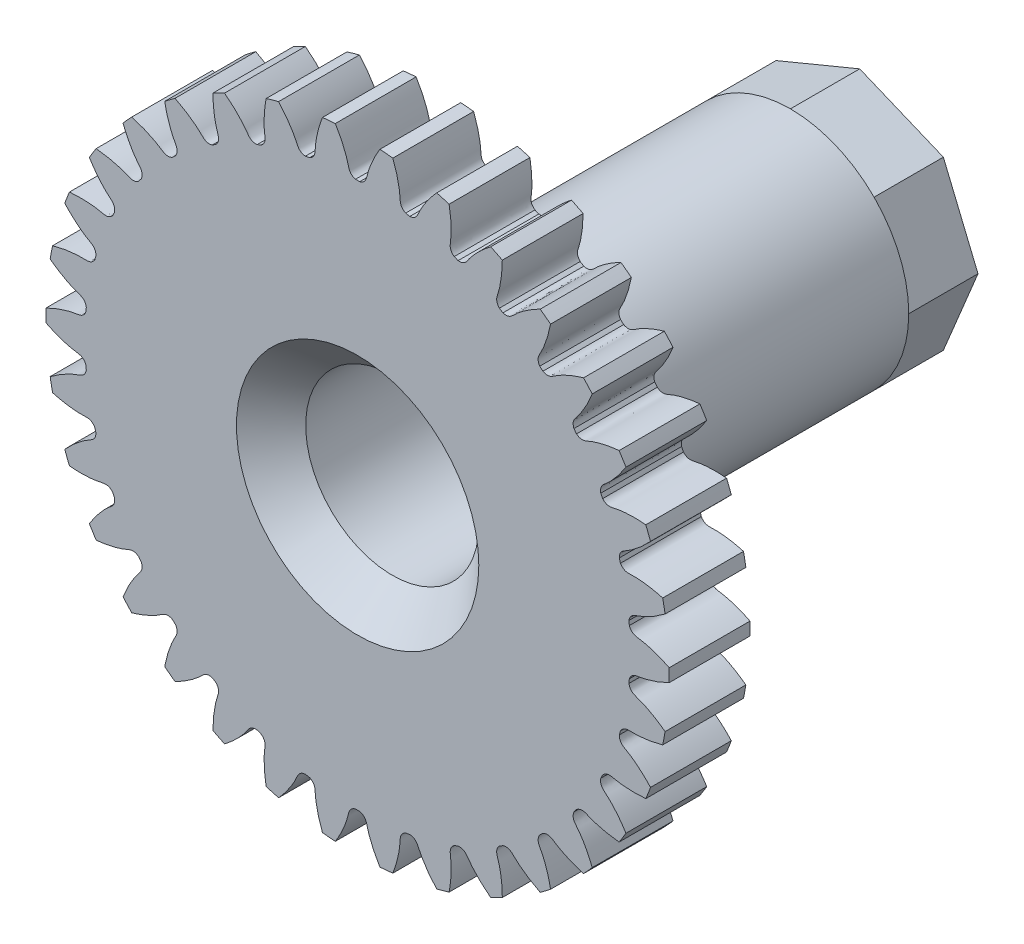
from build123d import *

# Parameters (mm, degrees)
SKETCH_1_R               = 27
EXTRUDE_1_DEPTH          = 7
CUT_EXTRUDE_1_DEPTH      = 39.820097888
PATTERN_CIRCULAR_1_COUNT = 34
EXTRUDE_START            = -7
SKETCH_5_R               = 21
EXTRUDE_2_DEPTH          = 1
SKETCH_4_R               = 7.5
CUT_EXTRUDE_2_DEPTH      = 39.964927539
CHAMFER_1_SIZE           = 3
EXTRUDE_START_2          = -8
SKETCH_6_R               = 10.25
SKETCH_6_R_2             = 7.5
EXTRUDE_3_DEPTH          = 35.5
CHAMFER_1_2_SIZE         = 3
SKETCH_7_OUTSIDE_W       = 73.56
SKETCH_7_OUTSIDE_H       = 73.422
CUT_EXTRUDE_3_DEPTH      = 6


with BuildPart() as part:
    # 草图1 → 凸台-拉伸1 (new body)
    with BuildSketch(Plane.XY):
        Circle(SKETCH_1_R)
    extrude(amount=EXTRUDE_1_DEPTH)

    # 草图2 → 切除-拉伸1 (cut, through all)
    with BuildSketch(Plane.XY):
        with BuildLine():
            ThreePointArc((0.183171175, 23.624289901), (0, 23.625), (-0.183171175, 23.624289901))
            add(Edge.make_bspline(
                [(-0.183171175, 23.624289901), (-0.716587806, 23.775112896), (-0.763410395, 24.188787315), (-0.879946356, 24.623629896), (-0.912930358, 24.738245821), (-0.951084244, 24.861314333), (-0.99469329, 24.992699977), (-1.044123655, 25.132221413), (-1.099711127, 25.279697341), (-1.161793992, 25.434932943), (-1.230702926, 25.597724076), (-1.306763614, 25.76785621), (-1.390295632, 25.945104927), (-1.481612426, 26.129235971), (-1.581020975, 26.320005435), (-1.688821555, 26.51715992), (-1.805307471, 26.720436707), (-1.930764813, 26.929563939), (-2.065472203, 27.144260803), (-2.209700557, 27.364237722), (-2.36371284, 27.589196551), (-2.527763841, 27.818830783), (-2.702099938, 28.052825758), (-2.886958877, 28.290858874), (-3.082569553, 28.532599812), (-3.289151799, 28.777710761), (-3.506916179, 29.025846649), (-3.73606378, 29.276655378), (-3.97678604, 29.52977807), (-4.229264468, 29.784849315), (-4.586391615, 30.131497572), (-4.865591808, 30.386500811), (-5.057363345, 30.554916542)],
                knots=[0, 0, 0, 0, 0.13072362, 0.143503881, 0.157401081, 0.17241522, 0.188546299, 0.205794316, 0.224159273, 0.243641169, 0.264240005, 0.285955779, 0.308788493, 0.332738146, 0.357804738, 0.383988269, 0.411288739, 0.439706149, 0.469240498, 0.499891786, 0.531660014, 0.56454518, 0.598547286, 0.633666331, 0.669902315, 0.707255238, 0.745725101, 0.785311903, 0.826015644, 0.867836324, 0.910773943, 1, 1, 1, 1], degree=3))
            ThreePointArc((-5.057363345, 30.554916542), (0, 30.970628811), (5.057363345, 30.554916542))
            add(Edge.make_bspline(
                [(0.183171175, 23.624289901), (0.716587806, 23.775112896), (0.763410395, 24.188787315), (0.879946356, 24.623629896), (0.912930358, 24.738245821), (0.951084244, 24.861314333), (0.99469329, 24.992699977), (1.044123655, 25.132221413), (1.099711127, 25.279697341), (1.161793992, 25.434932943), (1.230702926, 25.597724076), (1.306763614, 25.76785621), (1.390295632, 25.945104927), (1.481612426, 26.129235971), (1.581020975, 26.320005435), (1.688821555, 26.51715992), (1.805307471, 26.720436707), (1.930764813, 26.929563939), (2.065472203, 27.144260803), (2.209700557, 27.364237722), (2.36371284, 27.589196551), (2.527763841, 27.818830783), (2.702099938, 28.052825758), (2.886958877, 28.290858874), (3.082569553, 28.532599812), (3.289151799, 28.777710761), (3.506916179, 29.025846649), (3.73606378, 29.276655378), (3.97678604, 29.52977807), (4.229264468, 29.784849315), (4.586391615, 30.131497572), (4.865591808, 30.386500811), (5.057363345, 30.554916542)],
                knots=[0, 0, 0, 0, 0.13072362, 0.143503881, 0.157401081, 0.17241522, 0.188546299, 0.205794316, 0.224159273, 0.243641169, 0.264240005, 0.285955779, 0.308788493, 0.332738146, 0.357804738, 0.383988269, 0.411288739, 0.439706149, 0.469240498, 0.499891786, 0.531660014, 0.56454518, 0.598547286, 0.633666331, 0.669902315, 0.707255238, 0.745725101, 0.785311903, 0.826015644, 0.867836324, 0.910773943, 1, 1, 1, 1], degree=3))
        make_face()
    cut_extrude_1 = extrude(amount=CUT_EXTRUDE_1_DEPTH, mode=Mode.SUBTRACT)

    # 阵列(圆周)1: 切除-拉伸1 ×34 about axis
    pattern_circular_1_axis = Axis((0, 0, -1.5), (0, 0, 1))
    for i in range(1, PATTERN_CIRCULAR_1_COUNT):
        add(cut_extrude_1.rotate(pattern_circular_1_axis, i * 360 / PATTERN_CIRCULAR_1_COUNT), mode=Mode.SUBTRACT)

    # 草图5 → 凸台-拉伸2 (add)
    with BuildSketch(Plane.XY.offset(7).offset(EXTRUDE_START)):
        Circle(SKETCH_5_R)
    extrude(amount=-EXTRUDE_2_DEPTH)

    # 草图4 → 切除-拉伸2 (cut, through all)
    with BuildSketch(Plane.XY.offset(7)):
        Circle(SKETCH_4_R)
    extrude(amount=-CUT_EXTRUDE_2_DEPTH, mode=Mode.SUBTRACT)

    # 倒角1
    chamfer_1_edges = [part.edges().sort_by_distance(p)[0] for p in [
        (-7.5, 0, 7),
    ]]
    chamfer(chamfer_1_edges, length=CHAMFER_1_SIZE)

    # 草图6 → 凸台-拉伸3 (add)
    with BuildSketch(Plane.XY.offset(7).offset(EXTRUDE_START_2)):
        Circle(SKETCH_6_R)
        Circle(SKETCH_6_R_2, mode=Mode.SUBTRACT)
    extrude(amount=-EXTRUDE_3_DEPTH)

    # Chamfer 1 2
    chamfer_1_2_edges = [part.edges().sort_by_distance(p)[0] for p in [
        (-10.25, 0, -1),
    ]]
    chamfer(chamfer_1_2_edges, length=CHAMFER_1_2_SIZE)

    # 草图7 outside → 切除-拉伸3 (cut)
    with BuildSketch(Plane(origin=(0, 0, -36.5), x_dir=(-1, 0, 0), z_dir=(0, 0, -1))):
        Rectangle(SKETCH_7_OUTSIDE_W, SKETCH_7_OUTSIDE_H)
        Polygon((0, 10.25), (-7.247844507, 7.247844507), (-10.25, 0), (-7.247844507, -7.247844507), (0, -10.25), (7.247844507, -7.247844507), (10.25, 0), (7.247844507, 7.247844507), align=None, mode=Mode.SUBTRACT)
    extrude(amount=-CUT_EXTRUDE_3_DEPTH, mode=Mode.SUBTRACT)


solid = part.part
